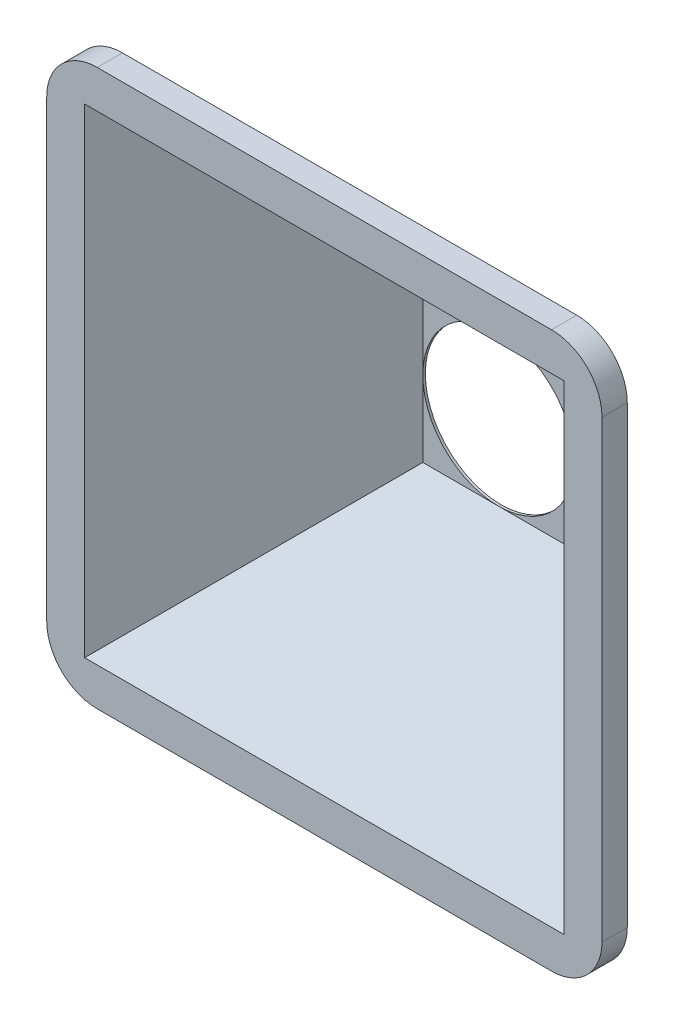
from build123d import *

# Parameters (mm, degrees)
SKETCH_3_W        = 1100.003182852
SKETCH_3_H        = 1100.38021032
EXTRUDE_1_DEPTH   = 50
FILLET_1_R        = 100
FILLET_3_R        = 100
FILLET_4_R        = 100
FILLET_5_R        = 100
EXTRUDE_2_DEPTH   = 5
EXTRUDE_2_2_DEPTH = 5
EXTRUDE_2_3_DEPTH = 5
EXTRUDE_2_4_DEPTH = 5


with BuildPart() as part:
    # 스케치1 → Loft 1 section 0
    with BuildSketch(Plane.XY):
        with BuildLine():
            Line((200, -200), (-200, -200))
            Line((-200, -200), (-200, 200))
            Line((-200, 200), (200, 200))
            Line((200, 200), (200, -200))
        make_face()
    # 스케치2 → Loft 1 section 1
    with BuildSketch(Plane.XY.offset(300)):
        with BuildLine():
            Line((500, -500), (-500, -500))
            Line((-500, -500), (-500, 500))
            Line((-500, 500), (500, 500))
            Line((500, 500), (500, -500))
        make_face()
    loft()

    # 스케치3 → 보스-돌출1 (add)
    with BuildSketch(Plane.XY.offset(300)):
        Rectangle(SKETCH_3_W, SKETCH_3_H)
    extrude(amount=EXTRUDE_1_DEPTH)

    # 필렛1
    fillet_1_edges = [part.edges().sort_by_distance(p)[0] for p in [
        (-550.001591426, -550.19010516, 325),
    ]]
    fillet(fillet_1_edges, radius=FILLET_1_R)

    # 필렛3
    fillet_3_edges = [part.edges().sort_by_distance(p)[0] for p in [
        (550.001591426, -550.19010516, 325),
    ]]
    fillet(fillet_3_edges, radius=FILLET_3_R)

    # 필렛4
    fillet_4_edges = [part.edges().sort_by_distance(p)[0] for p in [
        (-550.001591426, 550.19010516, 325),
    ]]
    fillet(fillet_4_edges, radius=FILLET_4_R)

    # 필렛5
    fillet_5_edges = [part.edges().sort_by_distance(p)[0] for p in [
        (550.001591426, 550.19010516, 325),
    ]]
    fillet(fillet_5_edges, radius=FILLET_5_R)

    # 스케치5 → Loft 1 2 section 0
    with BuildSketch(Plane(origin=(0, 0, 0), x_dir=(-1, 0, 0), z_dir=(0, 0, -1))):
        with BuildLine():
            Line((150, -150), (-150, -150))
            Line((-150, -150), (-150, 150))
            Line((-150, 150), (150, 150))
            Line((150, 150), (150, -150))
        make_face()
    # 스케치4 → Loft 1 2 section 1
    with BuildSketch(Plane.XY.offset(350)):
        with BuildLine():
            Line((475, -475), (-475, -475))
            Line((-475, -475), (-475, 475))
            Line((-475, 475), (475, 475))
            Line((475, 475), (475, -475))
        make_face()
    loft(mode=Mode.SUBTRACT)


with BuildPart() as body_2:
    # 스케치6 → 보스-돌출2 (new body)
    with BuildSketch(Plane.XY):
        with BuildLine():
            Line((-150, 150), (-150, 2.07e-07))
            ThreePointArc((-150, 2.07e-07), (-106.066017068, 106.066017288), (1.03e-07, 150))
            Line((1.03e-07, 150), (-150, 150))
        make_face()
    extrude(amount=EXTRUDE_2_DEPTH)


with BuildPart() as body_3:
    # 스케치6 → Extrude 2 2 (new body)
    with BuildSketch(Plane.XY):
        with BuildLine():
            Line((-150, -150), (-3.1e-07, -150))
            ThreePointArc((-3.1e-07, -150), (-106.066017361, -106.066016995), (-150, 2.07e-07))
            Line((-150, 2.07e-07), (-150, -150))
        make_face()
    extrude(amount=EXTRUDE_2_2_DEPTH)


with BuildPart() as body_4:
    # 스케치6 → Extrude 2 3 (new body)
    with BuildSketch(Plane.XY):
        with BuildLine():
            ThreePointArc((1.03e-07, 150), (106.066017215, 106.066017141), (150, 0))
            Line((150, 0), (150, 150))
            Line((150, 150), (1.03e-07, 150))
        make_face()
    extrude(amount=EXTRUDE_2_3_DEPTH)


with BuildPart() as body_5:
    # 스케치6 → Extrude 2 4 (new body)
    with BuildSketch(Plane.XY):
        with BuildLine():
            Line((-3.1e-07, -150), (150, -150))
            Line((150, -150), (150, 0))
            ThreePointArc((150, 0), (106.066017068, -106.066017288), (-3.1e-07, -150))
        make_face()
    extrude(amount=EXTRUDE_2_4_DEPTH)


solid = Compound([part.part, body_2.part, body_3.part, body_4.part, body_5.part])
